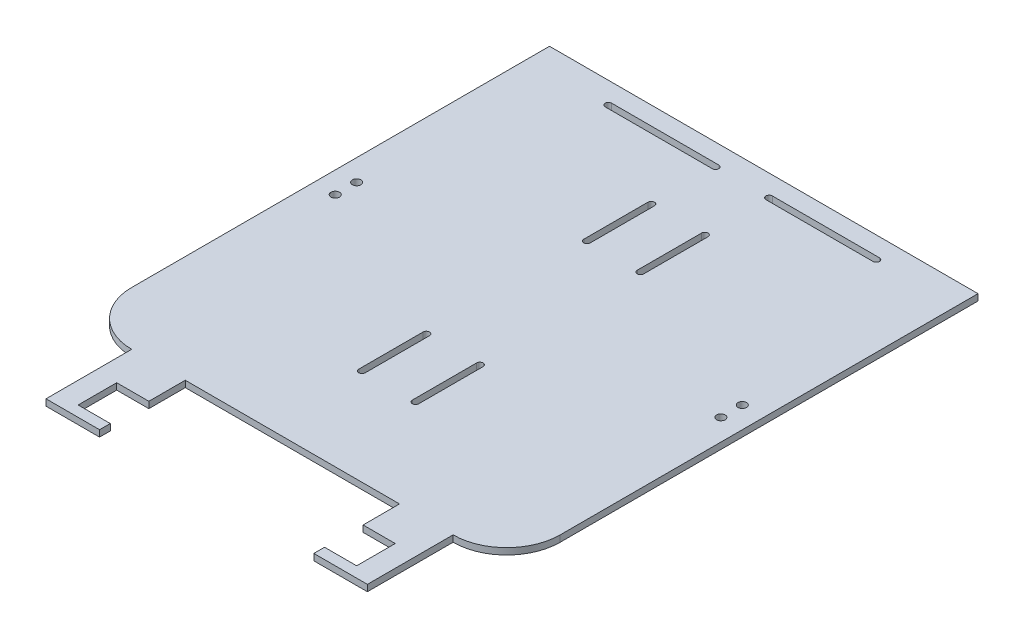
from build123d import *

# Parameters (mm, degrees)
SKETCH1_R           = 2
BOSS_EXTRUDE1_DEPTH = 3
SKETCH1_3_W         = 25
SKETCH1_3_H         = 40
BOSS_EXTRUDE4_DEPTH = 3
SKETCH4_W           = 5
SKETCH4_H           = 18
CUT_EXTRUDE1_DEPTH  = 10
SKETCH5_W           = 10
SKETCH5_H           = 18
CUT_EXTRUDE2_DEPTH  = 10
SKETCH8_W           = 10
SKETCH8_H           = 18
CUT_EXTRUDE3_DEPTH  = 10
SKETCH9_W           = 10
SKETCH9_H           = 65
BOSS_EXTRUDE7_DEPTH = 3


with BuildPart() as part:
    # Sketch1 → Boss-Extrude1 (new body)
    with BuildSketch(Plane(origin=(0, 0, 0), x_dir=(1, 0, 0), z_dir=(0, 1, 0))):
        with BuildLine():
            ThreePointArc((-100, 25), (-92.67766953, 7.32233047), (-75, 0))
            Line((-75, 0), (-50, 0))
            Line((-50, 0), (50, 0))
            Line((50, 0), (75, 0))
            ThreePointArc((75, 0), (92.67766953, 7.32233047), (100, 25))
            Line((100, 25), (100, 135))
            Line((100, 135), (90, 135))
            Line((90, 135), (90, 200))
            Line((90, 200), (100, 200))
            Line((100, 200), (100, 220))
            Line((100, 220), (-100, 220))
            Line((-100, 220), (-100, 200))
            Line((-100, 200), (-90, 200))
            Line((-90, 200), (-90, 135))
            Line((-90, 135), (-100, 135))
            Line((-100, 135), (-100, 25))
        make_face()
        with BuildLine():
            Line((-14, 45), (-14, 75))
            ThreePointArc((-14, 75), (-12.5, 76.5), (-11, 75))
            Line((-11, 75), (-11, 45))
            ThreePointArc((-11, 45), (-12.5, 43.5), (-14, 45))
        make_face(mode=Mode.SUBTRACT)
        with BuildLine():
            ThreePointArc((11, 75), (12.5, 76.5), (14, 75))
            Line((14, 75), (14, 45))
            ThreePointArc((14, 45), (12.5, 43.5), (11, 45))
            Line((11, 45), (11, 75))
        make_face(mode=Mode.SUBTRACT)
        with Locations((-90, 110)):
            Circle(SKETCH1_R, mode=Mode.SUBTRACT)
        with Locations((-90, 120)):
            Circle(SKETCH1_R, mode=Mode.SUBTRACT)
        with BuildLine():
            Line((-14, 150), (-14, 180))
            ThreePointArc((-14, 180), (-12.5, 181.5), (-11, 180))
            Line((-11, 180), (-11, 150))
            ThreePointArc((-11, 150), (-12.5, 148.5), (-14, 150))
        make_face(mode=Mode.SUBTRACT)
        with BuildLine():
            Line((-62.5, 211.5), (-12.5, 211.5))
            ThreePointArc((-12.5, 211.5), (-11, 210), (-12.5, 208.5))
            Line((-12.5, 208.5), (-62.5, 208.5))
            ThreePointArc((-62.5, 208.5), (-64, 210), (-62.5, 211.5))
        make_face(mode=Mode.SUBTRACT)
        with Locations((90, 110)):
            Circle(SKETCH1_R, mode=Mode.SUBTRACT)
        with Locations((90, 120)):
            Circle(SKETCH1_R, mode=Mode.SUBTRACT)
        with BuildLine():
            ThreePointArc((11, 180), (12.5, 181.5), (14, 180))
            Line((14, 180), (14, 150))
            ThreePointArc((14, 150), (12.5, 148.5), (11, 150))
            Line((11, 150), (11, 180))
        make_face(mode=Mode.SUBTRACT)
        with BuildLine():
            ThreePointArc((12.5, 208.5), (11, 210), (12.5, 211.5))
            Line((12.5, 211.5), (62.5, 211.5))
            ThreePointArc((62.5, 211.5), (64, 210), (62.5, 208.5))
            Line((62.5, 208.5), (12.5, 208.5))
        make_face(mode=Mode.SUBTRACT)
    extrude(amount=BOSS_EXTRUDE1_DEPTH)

    # Sketch1<3> → Boss-Extrude4 (add)
    with BuildSketch(Plane(origin=(0, 0, 0), x_dir=(1, 0, 0), z_dir=(0, 1, 0))):
        with Locations((-62.5, -20)):
            Rectangle(SKETCH1_3_W, SKETCH1_3_H)
        with Locations((62.5, -20)):
            Rectangle(SKETCH1_3_W, SKETCH1_3_H)
    extrude(amount=BOSS_EXTRUDE4_DEPTH)

    # Sketch4 → Cut-Extrude1 (cut)
    with BuildSketch(Plane(origin=(0, 3, 0), x_dir=(1, 0, 0), z_dir=(0, 1, 0))):
        with Locations((-52.5, -26)):
            Rectangle(SKETCH4_W, SKETCH4_H)
        with Locations((52.5, -26)):
            Rectangle(SKETCH4_W, SKETCH4_H)
    extrude(amount=-CUT_EXTRUDE1_DEPTH, mode=Mode.SUBTRACT)

    # Sketch5 → Cut-Extrude2 (cut)
    with BuildSketch(Plane(origin=(0, 3, 0), x_dir=(1, 0, 0), z_dir=(0, 1, 0))):
        with Locations((60, -26)):
            Rectangle(SKETCH5_W, SKETCH5_H)
    extrude(amount=-CUT_EXTRUDE2_DEPTH, mode=Mode.SUBTRACT)

    # Sketch8 → Cut-Extrude3 (cut)
    with BuildSketch(Plane(origin=(0, 3, 0), x_dir=(1, 0, 0), z_dir=(0, 1, 0))):
        with Locations((-60, -26)):
            Rectangle(SKETCH8_W, SKETCH8_H)
    extrude(amount=-CUT_EXTRUDE3_DEPTH, mode=Mode.SUBTRACT)

    # Sketch9 → Boss-Extrude7 (add)
    with BuildSketch(Plane(origin=(0, 3, 0), x_dir=(1, 0, 0), z_dir=(0, 1, 0))):
        with Locations((-95, 167.5)):
            Rectangle(SKETCH9_W, SKETCH9_H)
        with Locations((95, 167.5)):
            Rectangle(SKETCH9_W, SKETCH9_H)
    extrude(amount=-BOSS_EXTRUDE7_DEPTH)


solid = part.part
